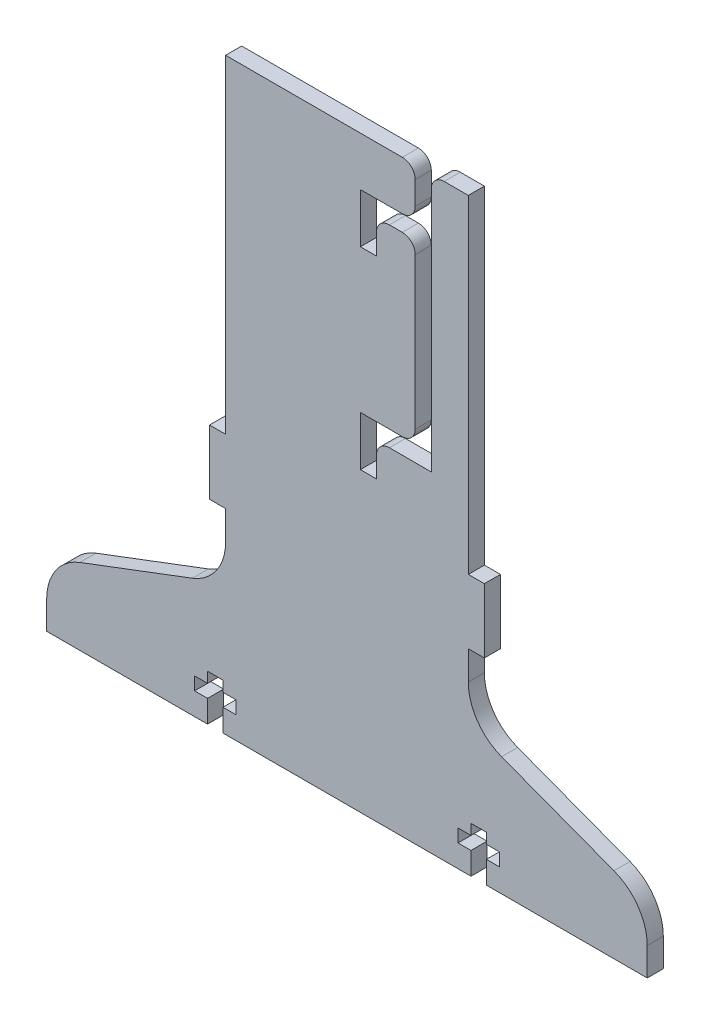
from build123d import *

# Parameters (mm, degrees)
BOSS_EXTRUDE1_DEPTH = 3.175
SKETCH2_W           = 5.42671
SKETCH2_H           = 83.83778
SKETCH2_W_2         = 23.424388
BOSS_EXTRUDE2_DEPTH = 3.175
SKETCH3_W           = 3.175
SKETCH3_H           = 64.78778
SKETCH3_H_2         = 6.35
CUT_EXTRUDE2_DEPTH  = 92.344542194
BOSS_EXTRUDE4_DEPTH = 3.175
FILLET1_R           = 10.16
CUT_EXTRUDE5_DEPTH  = 109.16364837
FILLET2_R           = 2.54


with BuildPart() as part:
    # Sketch1 → Boss-Extrude1 (new body)
    with BuildSketch(Plane.XY):
        Polygon((4.470127528, 71.013782114), (4.470127528, 36.088782114), (-6.35, 36.088782114), (-6.35, 32.913782114), (-6.35, 26.309782114), (-3.175, 26.309782114), (-3.175, 32.913782114), (7.645127528, 32.913782114), (7.645127528, 83.83778), (12.7, 83.83778), (12.7, 0), (-12.7, 0), (-12.7, 83.83778), (4.470127528, 83.83778), (4.470127528, 74.188782114), (-6.35, 74.188782114), (-6.35, 71.013782114), (-6.35, 64.409782114), (-3.175, 64.409782114), (-3.175, 71.013782114), align=None)
    extrude(amount=BOSS_EXTRUDE1_DEPTH)

    # Sketch2 → Boss-Extrude2 (add)
    with BuildSketch(Plane.XY):
        with Locations((15.413355, 41.91889)):
            Rectangle(SKETCH2_W, SKETCH2_H)
        with Locations((-24.412194, 41.91889)):
            Rectangle(SKETCH2_W_2, SKETCH2_H)
    extrude(amount=BOSS_EXTRUDE2_DEPTH)

    # Sketch3 → Cut-Extrude2 (cut, through all)
    with BuildSketch(Plane.XY):
        with Locations((-34.536888, 51.44389)):
            Rectangle(SKETCH3_W, SKETCH3_H)
        with Locations((16.53921, 51.44389)):
            Rectangle(SKETCH3_W, SKETCH3_H)
        with Locations((-34.536888, 3.175)):
            Rectangle(SKETCH3_W, SKETCH3_H_2)
        with Locations((16.53921, 3.175)):
            Rectangle(SKETCH3_W, SKETCH3_H_2)
    extrude(amount=CUT_EXTRUDE2_DEPTH, mode=Mode.SUBTRACT)

    # Sketch5 → Boss-Extrude4 (add)
    with BuildSketch(Plane.XY):
        Polygon((-32.949388, 0), (-32.949388, -6.35), (-68.268007503, -19.717143922), (-68.268007503, -32.282068045), (50.270329503, -32.282068045), (50.270329503, -19.717143922), (14.95171, -6.35), (14.95171, 0), align=None)
    extrude(amount=BOSS_EXTRUDE4_DEPTH)

    # Fillet1
    fillet1_edges = [part.edges().sort_by_distance(p)[0] for p in [
        (-32.949388, -6.35, 1.5875),
        (-68.268007503, -19.717143922, 1.5875),
        (50.270329503, -19.717143922, 1.5875),
        (14.95171, -6.35, 1.5875),
    ]]
    fillet(fillet1_edges, radius=FILLET1_R)

    # Sketch6 → Cut-Extrude5 (cut, through all)
    with BuildSketch(Plane.XY):
        Polygon((-36.518007503, -32.282068045), (-36.518007503, -27.870697677), (-39.076507827, -27.870697677), (-39.076507827, -25.312197354), (-36.518007503, -25.312197354), (-36.518007503, -23.233415841), (-33.479788369, -23.233415841), (-33.479788369, -25.312197354), (-30.921288046, -25.312197354), (-30.921288046, -27.870697677), (-33.479788369, -27.870697677), (-33.479788369, -32.282068045), align=None)
        Polygon((15.482110369, -32.282068045), (15.482110369, -27.870697677), (12.923610046, -27.870697677), (12.923610046, -25.312197354), (15.482110369, -25.312197354), (15.482110369, -23.233415841), (18.520329503, -23.233415841), (18.520329503, -25.312197354), (21.078829827, -25.312197354), (21.078829827, -27.870697677), (18.520329503, -27.870697677), (18.520329503, -32.282068045), align=None)
    extrude(amount=CUT_EXTRUDE5_DEPTH, mode=Mode.SUBTRACT)

    # Fillet2
    fillet2_edges = [part.edges().sort_by_distance(p)[0] for p in [
        (4.470127528, 83.83778, 1.5875),
        (4.470127528, 74.188782114, 1.5875),
        (-3.175, 71.013782114, 1.5875),
        (4.470127528, 71.013782114, 1.5875),
        (4.470127528, 36.088782114, 1.5875),
        (-3.175, 32.913782114, 1.5875),
        (7.645127528, 83.83778, 1.5875),
    ]]
    fillet(fillet2_edges, radius=FILLET2_R)


solid = part.part
